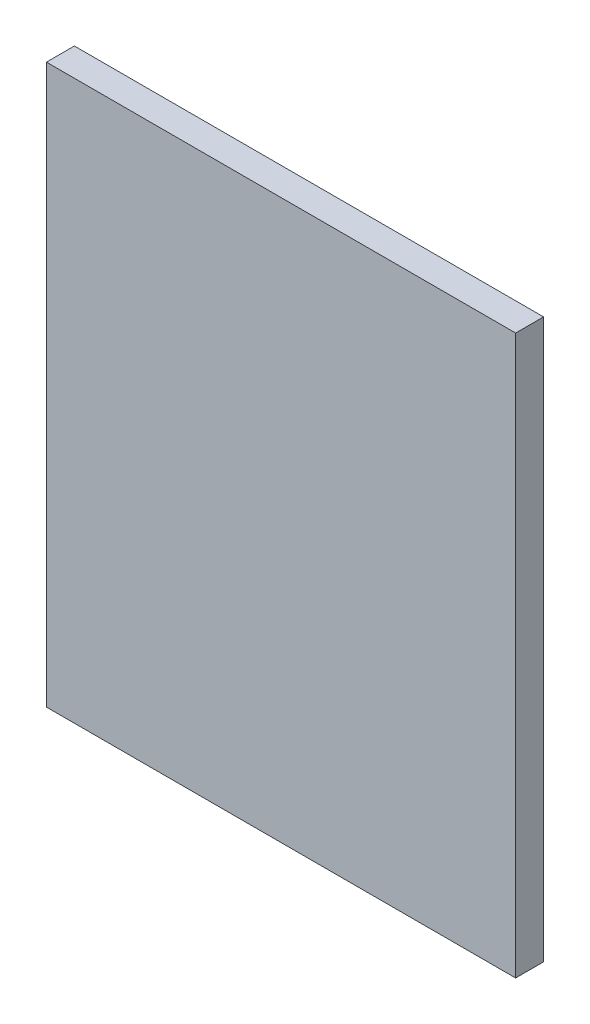
from build123d import *

# Parameters (mm, degrees)
ESBO_O1_W                = 42
ESBO_O1_H                = 50
RESSALTO_EXTRUS_O1_DEPTH = 2.5


with BuildPart() as part:
    # Esboço1 → Ressalto-extrusão1 (new body)
    with BuildSketch(Plane.XY):
        with Locations((-3.201219512, -5.088414634)):
            Rectangle(ESBO_O1_W, ESBO_O1_H)
    extrude(amount=RESSALTO_EXTRUS_O1_DEPTH)


solid = part.part
